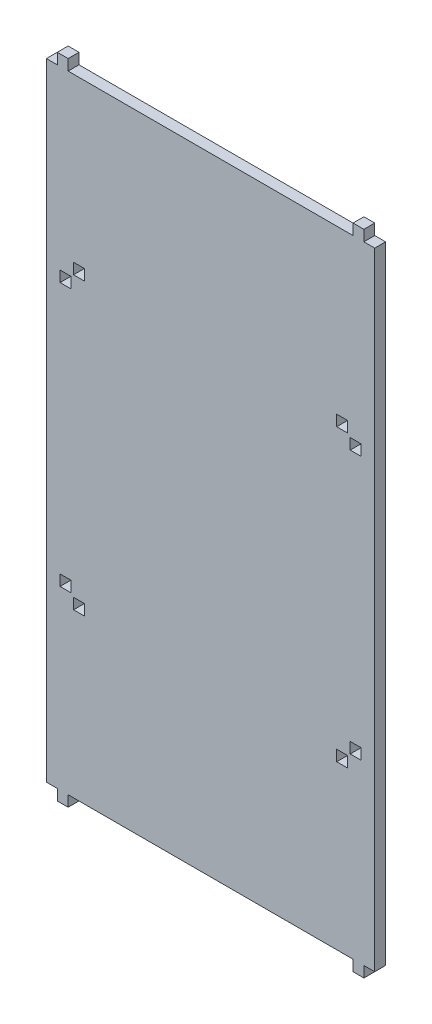
from build123d import *

# Parameters (mm, degrees)
SKETCH1_W           = 46.6
SKETCH1_H           = 98.55
BOSS_EXTRUDE1_DEPTH = 1.65
SKETCH3_W           = 1.65
SKETCH3_H           = 95.25
BOSS_EXTRUDE2_DEPTH = 1.65
SKETCH2_W           = 1.65
SKETCH2_H           = 1.65
CUT_EXTRUDE1_DEPTH  = 1.65
SKETCH4_W           = 43.3
SKETCH4_H           = 1.65
CUT_EXTRUDE2_DEPTH  = 1.65


with BuildPart() as part:
    # Sketch1 → Boss-Extrude1 (new body)
    with BuildSketch(Plane.XY):
        Rectangle(SKETCH1_W, SKETCH1_H)
    extrude(amount=BOSS_EXTRUDE1_DEPTH)

    # Sketch3 → Boss-Extrude2 (add)
    with BuildSketch(Plane.ZY.offset(23.3)):
        with Locations((0.825, 0)):
            Rectangle(SKETCH3_W, SKETCH3_H)
    boss_extrude2 = extrude(amount=BOSS_EXTRUDE2_DEPTH)

    # Mirror1: Boss-Extrude2 across plane
    add(boss_extrude2.mirror(Plane(origin=(0, 0, 0), x_dir=(0, 0, 1), z_dir=(1, 0, 0))))

    # Sketch2 → Cut-Extrude1 (cut)
    with BuildSketch(Plane.XY.offset(1.65)):
        with Locations((20, -22.05)):
            Rectangle(SKETCH2_W, SKETCH2_H)
        with Locations((-20, -22.05)):
            Rectangle(SKETCH2_W, SKETCH2_H)
        with Locations((-22.05, -20)):
            Rectangle(SKETCH2_W, SKETCH2_H)
        with Locations((-22.05, 20)):
            Rectangle(SKETCH2_W, SKETCH2_H)
        with Locations((-20, 22.05)):
            Rectangle(SKETCH2_W, SKETCH2_H)
        with Locations((20, 22.05)):
            Rectangle(SKETCH2_W, SKETCH2_H)
        with Locations((22.05, 20)):
            Rectangle(SKETCH2_W, SKETCH2_H)
        with Locations((22.05, -20)):
            Rectangle(SKETCH2_W, SKETCH2_H)
    extrude(amount=-CUT_EXTRUDE1_DEPTH, mode=Mode.SUBTRACT)

    # Sketch4 → Cut-Extrude2 (cut)
    with BuildSketch(Plane.XZ.offset(49.275)):
        with Locations((0, 0.825)):
            Rectangle(SKETCH4_W, SKETCH4_H)
    cut_extrude2 = extrude(amount=-CUT_EXTRUDE2_DEPTH, mode=Mode.SUBTRACT)

    # Mirror2: Cut-Extrude2 across plane
    add(cut_extrude2.mirror(Plane.ZX), mode=Mode.SUBTRACT)


solid = part.part
